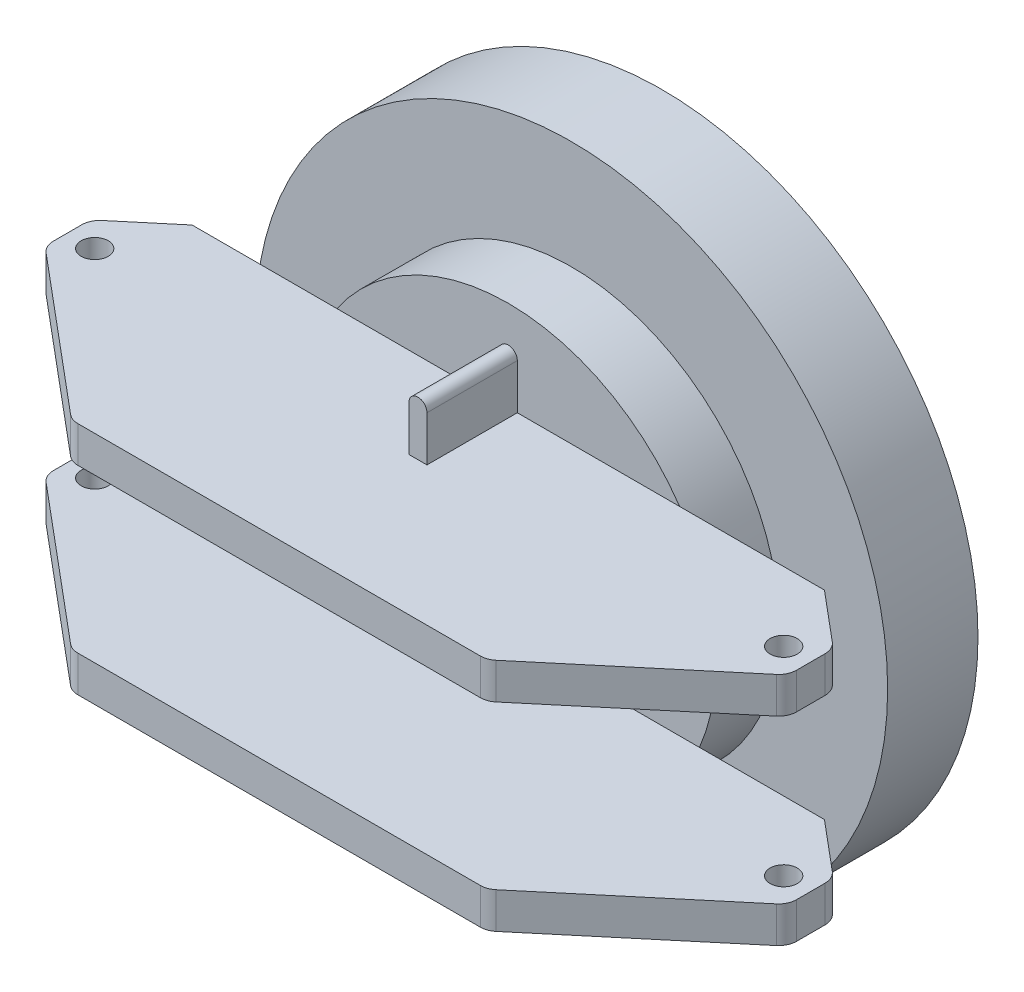
from build123d import *

# Parameters (mm, degrees)
SKETCH1_R                   = 35
BOSS_EXTRUDE1_DEPTH         = 10
SKETCH2_R                   = 23
BOSS_EXTRUDE2_DEPTH         = 7
BOSS_EXTRUDE3_DEPTH         = 4
SKETCH4_R                   = 1.5
CUT_EXTRUDE1_DEPTH          = 4
FILLET1_R                   = 2
FILLET1_OF_MIRROR1_R        = 2
SKETCH5_W                   = 2
SKETCH5_H                   = 6
BOSS_EXTRUDE4_DEPTH         = 10
FILLET2_RADIUS              = 1
FILLET2_LENGTH              = 10
FILLET2_OF_MIRROR2_2_RADIUS = 1
FILLET2_OF_MIRROR2_2_LENGTH = 10
SKETCH6_R                   = 15
CUT_EXTRUDE2_DEPTH          = 10


with BuildPart() as part:
    # Sketch1 → Boss-Extrude1 (new body)
    with BuildSketch(Plane.XY):
        Circle(SKETCH1_R)
    extrude(amount=BOSS_EXTRUDE1_DEPTH)

    # Sketch2 → Boss-Extrude2 (add)
    with BuildSketch(Plane.XY.offset(10)):
        Circle(SKETCH2_R)
    extrude(amount=BOSS_EXTRUDE2_DEPTH)

    # Sketch3 → Boss-Extrude3 (add)
    with BuildSketch(Plane(origin=(0, 13, 0), x_dir=(1, 0, 0), z_dir=(0, 1, 0))):
        Polygon((35, -17), (-35, -17), (-41.135319403, -22.148144248), (-41.135319403, -27.148144248), (-23, -42.36548407), (23, -42.36548407), (41.135319403, -27.148144248), (41.135319403, -22.148144248), align=None)
    boss_extrude3 = extrude(amount=-BOSS_EXTRUDE3_DEPTH)

    # Sketch4 → Cut-Extrude1 (cut)
    with BuildSketch(Plane(origin=(0, 13, 0), x_dir=(1, 0, 0), z_dir=(0, 1, 0))):
        with Locations(Location((-38.135319403, -24.648144248, 0), (0, 0, 270))):
            Circle(SKETCH4_R)
        with Locations(Location((38.135319403, -24.648144248, 0), (0, 0, 90))):
            Circle(SKETCH4_R)
    cut_extrude1 = extrude(amount=-CUT_EXTRUDE1_DEPTH, mode=Mode.SUBTRACT)

    # Fillet1
    fillet1_edges = [part.edges().sort_by_distance(p)[0] for p in [
        (23, 11, 42.36548407),
        (-23, 11, 42.36548407),
        (-41.135319403, 11, 27.148144248),
        (-41.135319403, 11, 22.148144248),
        (41.135319403, 11, 22.148144248),
        (41.135319403, 11, 27.148144248),
    ]]
    fillet(fillet1_edges, radius=FILLET1_R)

    # Mirror1: Boss-Extrude3, Cut-Extrude1 across plane
    add(boss_extrude3.mirror(Plane.ZX))
    add(cut_extrude1.mirror(Plane.ZX), mode=Mode.SUBTRACT)

    # Fillet1 of Mirror1
    fillet1_of_mirror1_edges = [part.edges().sort_by_distance(p)[0] for p in [
        (23, -11, 42.36548407),
        (-23, -11, 42.36548407),
        (-41.135319403, -11, 27.148144248),
        (-41.135319403, -11, 22.148144248),
        (41.135319403, -11, 22.148144248),
        (41.135319403, -11, 27.148144248),
    ]]
    fillet(fillet1_of_mirror1_edges, radius=FILLET1_OF_MIRROR1_R)

    # Sketch5 → Boss-Extrude4 (add)
    with BuildSketch(Plane.XY.offset(17)):
        with Locations((0, 16)):
            Rectangle(SKETCH5_W, SKETCH5_H)
    boss_extrude4 = extrude(amount=BOSS_EXTRUDE4_DEPTH)

    # Fillet2: full round fillet: the end face becomes a half cylinder, R = half its width
    fillet2_face = Plane((0, 19, 22), x_dir=(0, 0, -1), z_dir=(0, 1, 0))  # on the end face: x along it, z out of the body
    fillet2_slab = fillet2_face.offset(-FILLET2_RADIUS / 2) * Box(FILLET2_LENGTH, 2 * FILLET2_RADIUS, FILLET2_RADIUS, mode=Mode.PRIVATE)  # the body's end, R deep
    fillet2_round = Plane((0, 18, 22), x_dir=(0, 1, 0), z_dir=(0, 0, -1)) * Cylinder(FILLET2_RADIUS, FILLET2_LENGTH, mode=Mode.PRIVATE)  # its axis R under the face
    add(fillet2_slab - fillet2_round, mode=Mode.SUBTRACT)

    # Mirror2: Boss-Extrude4 across plane
    add(boss_extrude4.mirror(Plane.ZX))

    # Fillet2 of Mirror2 2: full round fillet: the end face becomes a half cylinder, R = half its width
    fillet2_of_mirror2_2_face = Plane((0, -19, 22), x_dir=(0, 0, -1), z_dir=(0, -1, 0))  # on the end face: x along it, z out of the body
    fillet2_of_mirror2_2_slab = fillet2_of_mirror2_2_face.offset(-FILLET2_OF_MIRROR2_2_RADIUS / 2) * Box(FILLET2_OF_MIRROR2_2_LENGTH, 2 * FILLET2_OF_MIRROR2_2_RADIUS, FILLET2_OF_MIRROR2_2_RADIUS, mode=Mode.PRIVATE)  # the body's end, R deep
    fillet2_of_mirror2_2_round = Plane((0, -18, 22), x_dir=(0, -1, 0), z_dir=(0, 0, -1)) * Cylinder(FILLET2_OF_MIRROR2_2_RADIUS, FILLET2_OF_MIRROR2_2_LENGTH, mode=Mode.PRIVATE)  # its axis R under the face
    add(fillet2_of_mirror2_2_slab - fillet2_of_mirror2_2_round, mode=Mode.SUBTRACT)

    # Sketch6 → Cut-Extrude2 (cut)
    with BuildSketch(Plane(origin=(0, 0, 0), x_dir=(-1, 0, 0), z_dir=(0, 0, -1))):
        Circle(SKETCH6_R)
    extrude(amount=-CUT_EXTRUDE2_DEPTH, mode=Mode.SUBTRACT)


solid = part.part
